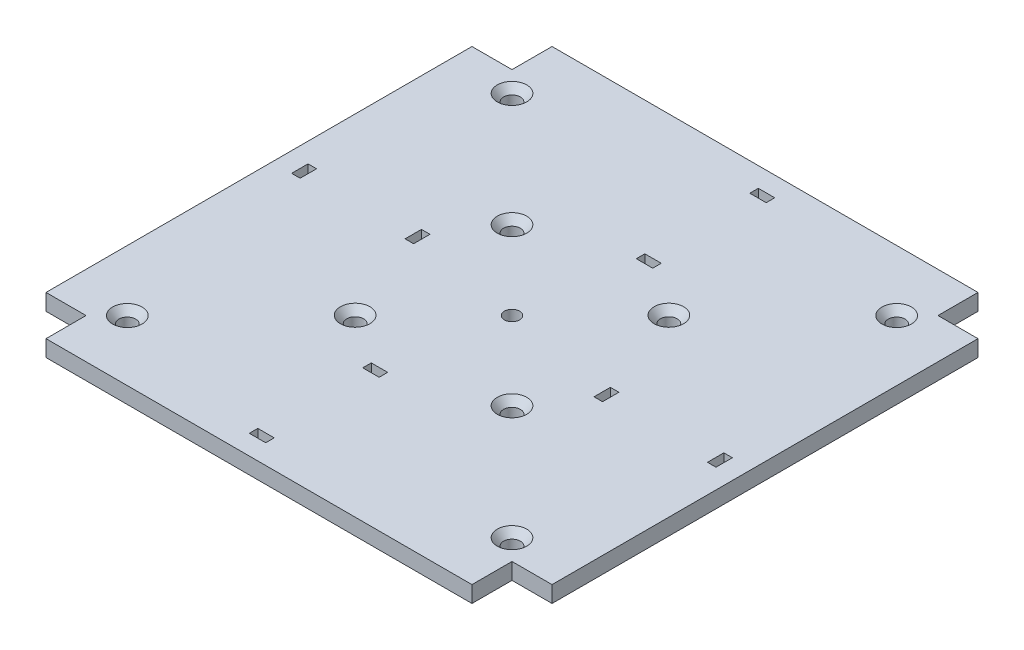
from build123d import *

# Parameters (mm, degrees)
SKETCH1_W                                     = 98
SKETCH1_H                                     = 98
BOSS_EXTRUDE1_DEPTH                           = 3.175
SKETCH2_W                                     = 7.5
SKETCH2_H                                     = 7.5
CUT_EXTRUDE1_DEPTH                            = 70.369161917
F_4_CLEARANCE_HOLE1_D                         = 2.9464
CSK_FOR_4_FLAT_HEAD_MACHINE_SCREW1_AT_2_COUNT = 2
CSK_FOR_4_FLAT_HEAD_MACHINE_SCREW1_AT_2_PITCH = 74.5
CSK_FOR_4_FLAT_HEAD_MACHINE_SCREW1_AT_3_COUNT = 2
CSK_FOR_4_FLAT_HEAD_MACHINE_SCREW1_AT_3_PITCH = 105.358910397
CSK_FOR_4_FLAT_HEAD_MACHINE_SCREW1_AT_4_COUNT = 2
CSK_FOR_4_FLAT_HEAD_MACHINE_SCREW1_AT_4_PITCH = 74.5
CSK_FOR_4_FLAT_HEAD_MACHINE_SCREW2_AT_2_COUNT = 2
CSK_FOR_4_FLAT_HEAD_MACHINE_SCREW2_AT_2_PITCH = 30.3784
CSK_FOR_4_FLAT_HEAD_MACHINE_SCREW2_AT_3_COUNT = 2
CSK_FOR_4_FLAT_HEAD_MACHINE_SCREW2_AT_3_PITCH = 42.961545283
CSK_FOR_4_FLAT_HEAD_MACHINE_SCREW2_AT_4_COUNT = 2
CSK_FOR_4_FLAT_HEAD_MACHINE_SCREW2_AT_4_PITCH = 30.3784
CUT_EXTRUDE2_DEPTH                            = 70.369161917
SKETCH16_W                                    = 1.651
SKETCH16_H                                    = 3.175
CUT_EXTRUDE3_DEPTH                            = 70.369161917
CIRPATTERN1_COUNT                             = 4


with BuildPart() as part:
    # Sketch1 → Boss-Extrude1 (new body)
    with BuildSketch(Plane(origin=(0, 0, 0), x_dir=(1, 0, 0), z_dir=(0, 1, 0))):
        Rectangle(SKETCH1_W, SKETCH1_H)
    extrude(amount=BOSS_EXTRUDE1_DEPTH)

    # Sketch2 → Cut-Extrude1 (cut, through all)
    with BuildSketch(Plane(origin=(0, 3.175, 0), x_dir=(1, 0, 0), z_dir=(0, 1, 0))):
        with Locations((45.25, 45.25)):
            Rectangle(SKETCH2_W, SKETCH2_H)
        with Locations((-45.25, 45.25)):
            Rectangle(SKETCH2_W, SKETCH2_H)
        with Locations((45.25, -45.25)):
            Rectangle(SKETCH2_W, SKETCH2_H)
        with Locations((-45.25, -45.25)):
            Rectangle(SKETCH2_W, SKETCH2_H)
    extrude(amount=-CUT_EXTRUDE1_DEPTH, mode=Mode.SUBTRACT)

    # #4 Clearance Hole1 (through all)
    with Locations(Plane(origin=(0, 3.175, 0), x_dir=(1, 0, 0), z_dir=(0, 1, 0))):
        with Locations((0, 0)):
            Hole(F_4_CLEARANCE_HOLE1_D / 2)

    # Sketch9 → CSK for #4 Flat Head Machine Screw1 (revolve, cut)
    with BuildSketch(Plane(origin=(37.25, 3.175, 37.25), x_dir=(0, 0, 1), z_dir=(1, 0, 0))):
        Polygon((0, 0), (0, 3.175), (1.63195, 3.175), (1.63195, 1.409834001), (2.8575, 0), align=None)
    csk_for_4_flat_head_machine_screw1 = revolve(axis=Axis((37.25, 9.525, 37.25), (0, -1, 0)), mode=Mode.SUBTRACT)

    # CSK for #4 Flat Head Machine Screw1 at 2: CSK for #4 Flat Head Machine Screw1 ×2
    with Locations(*[(-i * CSK_FOR_4_FLAT_HEAD_MACHINE_SCREW1_AT_2_PITCH, 0, 0) for i in range(1, CSK_FOR_4_FLAT_HEAD_MACHINE_SCREW1_AT_2_COUNT)]):
        add(csk_for_4_flat_head_machine_screw1, mode=Mode.SUBTRACT)

    # CSK for #4 Flat Head Machine Screw1 at 3: CSK for #4 Flat Head Machine Screw1 ×2
    with Locations(*[Vector(-0.7071067811865502, 0, -0.7071067811865448) * (i * CSK_FOR_4_FLAT_HEAD_MACHINE_SCREW1_AT_3_PITCH) for i in range(1, CSK_FOR_4_FLAT_HEAD_MACHINE_SCREW1_AT_3_COUNT)]):
        add(csk_for_4_flat_head_machine_screw1, mode=Mode.SUBTRACT)

    # CSK for #4 Flat Head Machine Screw1 at 4: CSK for #4 Flat Head Machine Screw1 ×2
    with Locations(*[(0, 0, -i * CSK_FOR_4_FLAT_HEAD_MACHINE_SCREW1_AT_4_PITCH) for i in range(1, CSK_FOR_4_FLAT_HEAD_MACHINE_SCREW1_AT_4_COUNT)]):
        add(csk_for_4_flat_head_machine_screw1, mode=Mode.SUBTRACT)

    # Sketch13 → CSK for #4 Flat Head Machine Screw2 (revolve, cut)
    with BuildSketch(Plane(origin=(15.1384, 3.175, -15.24), x_dir=(0, 0, 1), z_dir=(1, 0, 0))):
        Polygon((0, 0), (0, 3.175), (1.63195, 3.175), (1.63195, 1.409834001), (2.8575, 0), align=None)
    csk_for_4_flat_head_machine_screw2 = revolve(axis=Axis((15.1384, 9.525, -15.24), (0, -1, 0)), mode=Mode.SUBTRACT)

    # CSK for #4 Flat Head Machine Screw2 at 2: CSK for #4 Flat Head Machine Screw2 ×2
    with Locations(*[(-i * CSK_FOR_4_FLAT_HEAD_MACHINE_SCREW2_AT_2_PITCH, 0, 0) for i in range(1, CSK_FOR_4_FLAT_HEAD_MACHINE_SCREW2_AT_2_COUNT)]):
        add(csk_for_4_flat_head_machine_screw2, mode=Mode.SUBTRACT)

    # CSK for #4 Flat Head Machine Screw2 at 3: CSK for #4 Flat Head Machine Screw2 ×2
    with Locations(*[Vector(-0.7071067811865475, 0, 0.7071067811865477) * (i * CSK_FOR_4_FLAT_HEAD_MACHINE_SCREW2_AT_3_PITCH) for i in range(1, CSK_FOR_4_FLAT_HEAD_MACHINE_SCREW2_AT_3_COUNT)]):
        add(csk_for_4_flat_head_machine_screw2, mode=Mode.SUBTRACT)

    # CSK for #4 Flat Head Machine Screw2 at 4: CSK for #4 Flat Head Machine Screw2 ×2
    with Locations(*[(0, 0, i * CSK_FOR_4_FLAT_HEAD_MACHINE_SCREW2_AT_4_PITCH) for i in range(1, CSK_FOR_4_FLAT_HEAD_MACHINE_SCREW2_AT_4_COUNT)]):
        add(csk_for_4_flat_head_machine_screw2, mode=Mode.SUBTRACT)

    # Sketch15 → Cut-Extrude2 (cut, through all)
    with BuildSketch(Plane(origin=(0, 3.175, 0), x_dir=(1, 0, 0), z_dir=(0, 1, 0))):
        Polygon((-48.746, -41.246), (-41.246, -41.246), (-41.246, -48.746), (-41.246, -49), (-41.5, -49), (-41.5, -41.5), (-49, -41.5), (-49, -41.246), align=None)
        Polygon((49, 41.246), (49, 41.5), (41.5, 41.5), (41.5, 49), (41.246, 49), (41.246, 48.746), (41.246, 41.246), (48.746, 41.246), align=None)
        Polygon((41.246, -48.746), (41.246, -41.246), (48.746, -41.246), (49, -41.246), (49, -41.5), (41.5, -41.5), (41.5, -49), (41.246, -49), align=None)
        Polygon((-41.246, 48.746), (-41.246, 41.246), (-48.746, 41.246), (-49, 41.246), (-49, 41.5), (-41.5, 41.5), (-41.5, 49), (-41.246, 49), align=None)
    extrude(amount=-CUT_EXTRUDE2_DEPTH, mode=Mode.SUBTRACT)

    # Sketch16 → Cut-Extrude3 (cut, through all)
    with BuildSketch(Plane.XZ):
        with Locations((-44.3645, -4.0985)):
            Rectangle(SKETCH16_W, SKETCH16_H)
        with Locations((-22.3935, -4.0985)):
            Rectangle(SKETCH16_W, SKETCH16_H)
    cut_extrude3 = extrude(amount=-CUT_EXTRUDE3_DEPTH, mode=Mode.SUBTRACT)

    # CirPattern1: Cut-Extrude3 ×4 about axis
    cirpattern1_axis = Axis((0, 0, 0), (0, 1, 0))
    for i in range(1, CIRPATTERN1_COUNT):
        add(cut_extrude3.rotate(cirpattern1_axis, i * 360 / CIRPATTERN1_COUNT), mode=Mode.SUBTRACT)


solid = part.part
